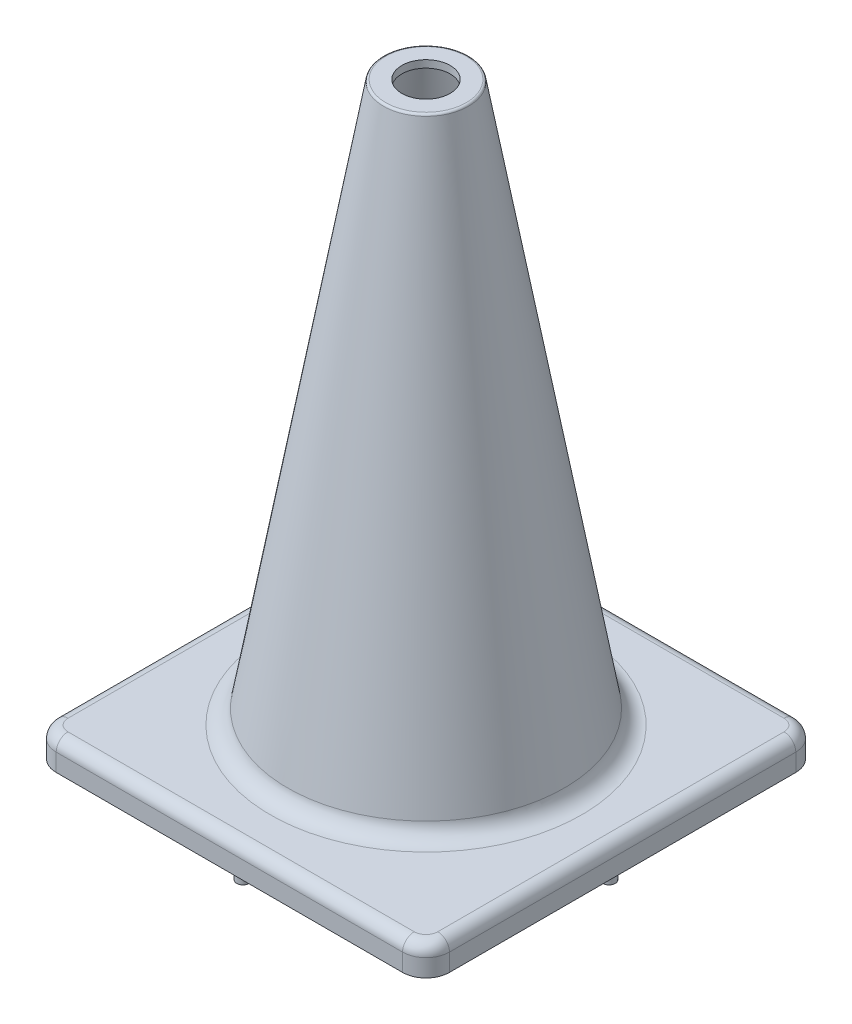
from build123d import *

# Parameters (mm, degrees)
BOSS_EXTRUDE1_DEPTH = 15.875
FILLET1_R           = 6.35
CUT_EXTRUDE1_DEPTH  = 11.90625
BOSS_EXTRUDE2_DEPTH = 11.90625
BOSS_EXTRUDE3_REACH = 154.17
FILLET2_R           = 4.7625


with BuildPart() as part:
    # Sketch1 → Boss-Extrude1 (new body)
    with BuildSketch(Plane(origin=(0, 0, 0), x_dir=(1, 0, 0), z_dir=(0, 1, 0))):
        with BuildLine():
            Line((-93.66249999999992, -106.36250000000007), (93.6624999999999, -106.36250000000003))
            ThreePointArc((93.6624999999999, -106.36250000000003), (102.64275612106913, -102.64275612106918), (106.36249999999998, -93.66249999999994))
            Line((106.36249999999998, -93.66249999999994), (106.36249999999998, 93.6624999999999))
            ThreePointArc((106.36249999999998, 93.6624999999999), (102.64275612106914, 102.64275612106914), (93.6624999999999, 106.36249999999998))
            Line((93.6624999999999, 106.36249999999998), (-93.66249999999992, 106.36249999999997))
            ThreePointArc((-93.66249999999992, 106.36249999999997), (-102.64275612106917, 102.64275612106913), (-106.36250000000001, 93.66249999999988))
            Line((-106.36250000000001, 93.66249999999988), (-106.36250000000001, -93.66249999999998))
            ThreePointArc((-106.36250000000001, -93.66249999999998), (-102.64275612106917, -102.64275612106923), (-93.66249999999992, -106.36250000000007))
        make_face()
    extrude(amount=BOSS_EXTRUDE1_DEPTH)

    # Fillet1
    fillet1_edges = [part.edges().sort_by_distance(p)[0] for p in [
        (102.64275612106913, 15.875, 102.64275612106918),
        (106.36249999999998, 15.875, 2.842e-14),
        (102.64275612106914, 15.875, -102.64275612106914),
        (-1.421e-14, 15.875, -106.36249999999998),
        (-102.64275612106917, 15.875, -102.64275612106913),
        (-106.36250000000001, 15.875, 5.684e-14),
        (-102.64275612106917, 15.875, 102.64275612106923),
        (-1.421e-14, 15.875, 106.36250000000004),
    ]]
    fillet(fillet1_edges, radius=FILLET1_R)

    # Sketch2 → Cut-Extrude1 (cut)
    with BuildSketch(Plane.XZ):
        Polygon((-102.39375000000017, 95.09729190163142), (-95.09729190163155, 102.39375000000014), (95.0972919016315, 102.39375000000007), (102.39375000000003, 95.09729190163166), (102.39375000000005, -95.09729190163151), (95.0972919016315, -102.39374999999998), (-95.09729190163166, -102.39374999999998), (-102.39375000000021, -95.0972919016317), align=None)
    extrude(amount=-CUT_EXTRUDE1_DEPTH, mode=Mode.SUBTRACT)

    # Sketch3 → Boss-Extrude2 (add)
    with BuildSketch(Plane.XZ.offset(-11.90625)):
        with BuildLine():
            Line((-3.3734374999999512, 102.39375000000007), (-3.3734374999999486, 86.71718750000007))
            ThreePointArc((-3.3734374999999486, 86.71718750000007), (-2.12e-15, 83.34375000000011), (3.373437500000051, 86.71718750000007))
            Line((3.373437500000051, 86.71718750000007), (3.3734375000000485, 102.39375000000007))
            Line((3.3734375000000485, 102.39375000000007), (-3.3734374999999512, 102.39375000000007))
        make_face()
        with BuildLine():
            Line((102.39375000001002, -3.3734374999903123), (86.71718750001003, -3.3734374999903154))
            ThreePointArc((86.71718750001003, -3.3734374999903154), (83.34375000001008, 9.73587e-12), (86.71718750001003, 3.3734375000096866))
            Line((86.71718750001003, 3.3734375000096866), (102.39375000001002, 3.3734375000096875))
            Line((102.39375000001002, 3.3734375000096875), (102.39375000001002, -3.3734374999903123))
        make_face()
        with BuildLine():
            Line((-3.3734374999803536, -102.39375000000028), (-3.373437499980358, -86.71718750000029))
            ThreePointArc((-3.373437499980358, -86.71718750000029), (1.969316e-11, -83.34375000000034), (3.3734375000196435, -86.71718750000029))
            Line((3.3734375000196435, -86.71718750000029), (3.3734375000196457, -102.39375000000028))
            Line((3.3734375000196457, -102.39375000000028), (-3.3734374999803536, -102.39375000000028))
        make_face()
        with BuildLine():
            Line((-102.39374999999033, 3.3734374999900774), (-86.71718749999035, 3.3734374999900822))
            ThreePointArc((-86.71718749999035, 3.3734374999900822), (-83.3437499999904, -9.96812e-12), (-86.71718749999035, -3.3734375000099193))
            Line((-86.71718749999035, -3.3734375000099193), (-102.39374999999033, -3.373437500009922))
            Line((-102.39374999999033, -3.373437500009922), (-102.39374999999033, 3.3734374999900774))
        make_face()
    extrude(amount=BOSS_EXTRUDE2_DEPTH)

    # Sketch4 → Boss-Extrude3 (add, up to next)
    with BuildSketch(Plane(origin=(0, -7.143750000000001, 0), x_dir=(-1, 0, 0), z_dir=(0, -1, 0)), mode=Mode.PRIVATE) as boss_extrude3_sk1:
        with BuildLine():
            Line((-94.8166588978488, 90.0458978335307), (-63.6663954778896, 58.89563441357118))
            ThreePointArc((-63.6663954778896, 58.89563441357118), (-58.89563441357163, 58.89563441357117), (-58.895634413571585, 63.66639547788915))
            Line((-58.895634413571585, 63.66639547788915), (-90.04589783353077, 94.81665889784867))
            ThreePointArc((-90.04589783353077, 94.81665889784867), (-94.81665889784875, 94.8166588978487), (-94.8166588978488, 90.0458978335307))
        make_face()
    boss_extrude3_tool1 = extrude(boss_extrude3_sk1.sketch, amount=-BOSS_EXTRUDE3_REACH, mode=Mode.PRIVATE) - part.part
    # Sketch4 → Boss-Extrude3 (add, up to next)
    with BuildSketch(Plane(origin=(0, -7.143750000000001, 0), x_dir=(-1, 0, 0), z_dir=(0, -1, 0)), mode=Mode.PRIVATE) as boss_extrude3_sk2:
        with BuildLine():
            Line((3.373437499980358, 86.71718750000029), (3.373437500019646, 99.02031250000026))
            ThreePointArc((3.373437500019646, 99.02031250000026), (2.1e-16, 102.3937500000199), (-3.373437500019646, 99.02031250000026))
            Line((-3.373437500019646, 99.02031250000026), (-3.3734375000196937, 86.71718750000029))
            ThreePointArc((-3.3734375000196937, 86.71718750000029), (-1.969358e-11, 83.3437500000003), (3.373437499980358, 86.71718750000029))
        make_face()
    boss_extrude3_tool2 = extrude(boss_extrude3_sk2.sketch, amount=-BOSS_EXTRUDE3_REACH, mode=Mode.PRIVATE) - part.part
    # Sketch4 → Boss-Extrude3 (add, up to next)
    with BuildSketch(Plane(origin=(0, -7.143750000000001, 0), x_dir=(-1, 0, 0), z_dir=(0, -1, 0)), mode=Mode.PRIVATE) as boss_extrude3_sk3:
        with BuildLine():
            Line((90.04589783353204, 94.81665889785549), (58.89563441357361, 63.66639547789739))
            ThreePointArc((58.89563441357361, 63.66639547789739), (58.89563441357358, 58.895634413579366), (63.666395477891626, 58.895634413579316))
            Line((63.666395477891626, 58.895634413579316), (94.81665889785005, 90.04589783353744))
            ThreePointArc((94.81665889785005, 90.04589783353744), (94.81665889785008, 94.81665889785545), (90.04589783353204, 94.81665889785549))
        make_face()
    boss_extrude3_tool3 = extrude(boss_extrude3_sk3.sketch, amount=-BOSS_EXTRUDE3_REACH, mode=Mode.PRIVATE) - part.part
    # Sketch4 → Boss-Extrude3 (add, up to next)
    with BuildSketch(Plane(origin=(0, -7.143750000000001, 0), x_dir=(-1, 0, 0), z_dir=(0, -1, 0)), mode=Mode.PRIVATE) as boss_extrude3_sk4:
        with BuildLine():
            Line((86.71718750000274, -3.3734375000119714), (99.0203125000027, -3.3734375000119674))
            ThreePointArc((99.0203125000027, -3.3734375000119674), (102.39375000002242, 7.74838e-12), (99.0203125000027, 3.373437500027471))
            Line((99.0203125000027, 3.373437500027471), (86.71718750000274, 3.373437500027467))
            ThreePointArc((86.71718750000274, 3.373437500027467), (83.34375000000271, 2.7441e-11), (86.71718750000274, -3.3734375000119714))
        make_face()
    boss_extrude3_tool4 = extrude(boss_extrude3_sk4.sketch, amount=-BOSS_EXTRUDE3_REACH, mode=Mode.PRIVATE) - part.part
    # Sketch4 → Boss-Extrude3 (add, up to next)
    with BuildSketch(Plane(origin=(0, -7.143750000000001, 0), x_dir=(-1, 0, 0), z_dir=(0, -1, 0)), mode=Mode.PRIVATE) as boss_extrude3_sk5:
        with BuildLine():
            Line((94.8166588978579, -90.04589783352434), (63.666395477899776, -58.895634413565915))
            ThreePointArc((63.666395477899776, -58.895634413565915), (58.89563441358186, -58.895634413565894), (58.89563441358178, -63.66639547788386))
            Line((58.89563441358178, -63.66639547788386), (90.0458978335399, -94.81665889784229))
            ThreePointArc((90.0458978335399, -94.81665889784229), (94.81665889785788, -94.81665889784232), (94.8166588978579, -90.04589783352434))
        make_face()
    boss_extrude3_tool5 = extrude(boss_extrude3_sk5.sketch, amount=-BOSS_EXTRUDE3_REACH, mode=Mode.PRIVATE) - part.part
    # Sketch4 → Boss-Extrude3 (add, up to next)
    with BuildSketch(Plane(origin=(0, -7.143750000000001, 0), x_dir=(-1, 0, 0), z_dir=(0, -1, 0)), mode=Mode.PRIVATE) as boss_extrude3_sk6:
        with BuildLine():
            Line((-3.3734375000095236, -86.71718749999499), (-3.3734375000095222, -99.02031249999496))
            ThreePointArc((-3.3734375000095222, -99.02031249999496), (1.019483e-11, -102.39375000001468), (3.373437500029913, -99.02031249999496))
            Line((3.373437500029913, -99.02031249999496), (3.373437500029912, -86.71718749999499))
            ThreePointArc((3.373437500029912, -86.71718749999499), (2.98871e-11, -83.34374999999497), (-3.3734375000095236, -86.71718749999499))
        make_face()
    boss_extrude3_tool6 = extrude(boss_extrude3_sk6.sketch, amount=-BOSS_EXTRUDE3_REACH, mode=Mode.PRIVATE) - part.part
    # Sketch4 → Boss-Extrude3 (add, up to next)
    with BuildSketch(Plane(origin=(0, -7.143750000000001, 0), x_dir=(-1, 0, 0), z_dir=(0, -1, 0)), mode=Mode.PRIVATE) as boss_extrude3_sk7:
        with BuildLine():
            Line((-90.04589783352185, -94.81665889785019), (-58.89563441356342, -63.666395477892074))
            ThreePointArc((-58.89563441356342, -63.666395477892074), (-58.89563441356341, -58.89563441357405), (-63.66639547788147, -58.89563441357399))
            Line((-63.66639547788147, -58.89563441357399), (-94.81665889783989, -90.04589783353212))
            ThreePointArc((-94.81665889783989, -90.04589783353212), (-94.8166588978399, -94.81665889785015), (-90.04589783352185, -94.81665889785019))
        make_face()
    boss_extrude3_tool7 = extrude(boss_extrude3_sk7.sketch, amount=-BOSS_EXTRUDE3_REACH, mode=Mode.PRIVATE) - part.part
    # Sketch4 → Boss-Extrude3 (add, up to next)
    with BuildSketch(Plane(origin=(0, -7.143750000000001, 0), x_dir=(-1, 0, 0), z_dir=(0, -1, 0)), mode=Mode.PRIVATE) as boss_extrude3_sk8:
        with BuildLine():
            Line((-86.71718749999255, 3.3734375000172827), (-99.02031249999251, 3.3734375000172805))
            ThreePointArc((-99.02031249999251, 3.3734375000172805), (-102.39375000001223, -2.43453e-12), (-99.02031249999251, -3.373437500022156))
            Line((-99.02031249999251, -3.373437500022156), (-86.71718749999255, -3.373437500022154))
            ThreePointArc((-86.71718749999255, -3.373437500022154), (-83.34374999999253, -2.212865e-11), (-86.71718749999255, 3.3734375000172827))
        make_face()
    boss_extrude3_tool8 = extrude(boss_extrude3_sk8.sketch, amount=-BOSS_EXTRUDE3_REACH, mode=Mode.PRIVATE) - part.part
    add(boss_extrude3_tool1.solids().sort_by_distance((76.856147, -7.14375, -76.856147))[0])
    add(boss_extrude3_tool2.solids().sort_by_distance((0, -7.14375, -92.86875))[0])
    add(boss_extrude3_tool3.solids().sort_by_distance((-76.856147, -7.14375, -76.856147))[0])
    add(boss_extrude3_tool4.solids().sort_by_distance((-92.86875, -7.14375, 0))[0])
    add(boss_extrude3_tool5.solids().sort_by_distance((-76.856147, -7.14375, 76.856147))[0])
    add(boss_extrude3_tool6.solids().sort_by_distance((0, -7.14375, 92.86875))[0])
    add(boss_extrude3_tool7.solids().sort_by_distance((76.856147, -7.14375, 76.856147))[0])
    add(boss_extrude3_tool8.solids().sort_by_distance((92.86875, -7.14375, 0))[0])

    # Fillet2
    fillet2_edges = [part.edges().sort_by_distance(p)[0] for p in [
        (49.23536470082557, 11.90625, -102.39374999999998),
        (-102.3937500000002, 11.90625, -49.23536470082082),
        (-102.39375000000018, 11.90625, 49.23536470081075),
        (-98.74552095081586, 11.90625, 98.74552095081577),
        (49.235364700815765, 11.90625, 102.39375000000008),
        (98.74552095081576, 11.90625, 98.74552095081586),
        (102.39375000000005, 11.90625, -49.235364700810905),
        (98.74552095081577, 11.90625, -98.74552095081575),
        (-49.23536470080602, 11.90625, -102.39374999999998),
        (-98.74552095081594, 11.90625, -98.74552095081584),
        (-49.23536470081575, 11.90625, 102.39375000000013),
        (102.39375000000003, 11.90625, 49.235364700820675),
    ]]
    fillet(fillet2_edges, radius=FILLET2_R)

    # Sketch5 → Revolve1 (revolve)
    with BuildSketch(Plane.XY, mode=Mode.PRIVATE) as revolve1_sk:
        with BuildLine():
            Line((74.81126348772762, 23.744742817785426), (23.01875, 317.2444509576286))
            ThreePointArc((23.01875, 317.2444509576286), (22.584348757978624, 317.99668119391566), (21.768073748005985, 318.29374999999993))
            Line((21.768073748005985, 318.29374999999993), (13.096874999999962, 318.29375))
            Line((13.096874999999962, 318.29375), (13.096874999999962, 314.325))
            Line((13.096874999999962, 314.325), (19.503862057662534, 314.325))
            Line((19.503862057662534, 314.325), (72.16993027415059, 15.874999999999972))
            Line((72.16993027415059, 15.874999999999972), (84.19133537768276, 15.875))
            ThreePointArc((84.19133537768276, 15.875), (78.06927280288797, 18.103016045632486), (74.81126348772762, 23.744742817785426))
        make_face()
    revolve(revolve1_sk.sketch.rotate(Axis((0, 0, 0), (0, 1, 0)), 90), axis=Axis((0, 0, 0), (0, 1, 0)))

    # Sketch6 → Cut-Revolve1 (revolve, cut)
    with BuildSketch(Plane.XY, mode=Mode.PRIVATE) as cut_revolve1_sk:
        Polygon((71.24410593263562, 21.121495211856818), (0, 21.121495211856953), (0, 11.906249999999991), (72.87027692596558, 11.906249999999893), (71.48154041369312, 19.775992817785358), align=None)
        with BuildLine():
            ThreePointArc((80.86161230364837, 11.906249999999883), (74.73954972885352, 14.134266045632378), (71.48154041369312, 19.775992817785358))
            Line((71.48154041369312, 19.775992817785358), (72.87027692596558, 11.90624999999988))
            Line((72.87027692596558, 11.906249999999893), (80.86161230364837, 11.906249999999883))
        make_face()
    revolve(cut_revolve1_sk.sketch.rotate(Axis((0, 11.906249999999991, 0), (0, 1, 0)), 90), axis=Axis((0, 11.906249999999991, 0), (0, 1, 0)), mode=Mode.SUBTRACT)


solid = part.part
